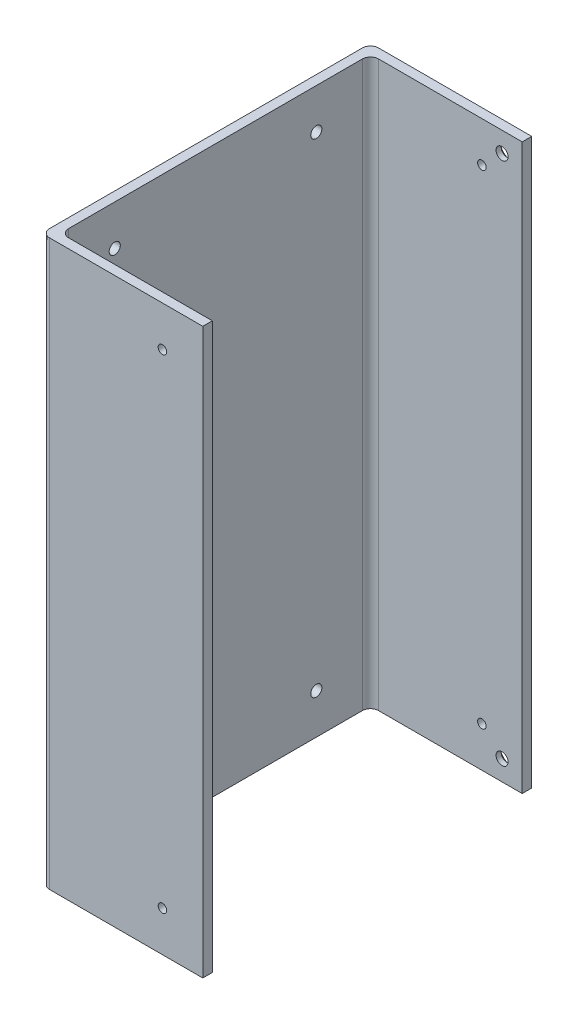
from build123d import *

# Parameters (mm, degrees)
EXTRUDE1_DEPTH                                    = 177.8
F_6_32_TAPPED_HOLE1_D                             = 2.7051
F_6_32_TAPPED_HOLE1_DEPTH                         = 9.38784
F_6_32_TAPPED_HOLE1_CBORE_D                       = 3.5052
F_6_32_TAPPED_HOLE1_CBORE_DEPTH                   = 7.0104
F_6_32_TAPPED_HOLE1_TIP                           = 0.81269403
F_6_32_TAPPED_HOLE2_D                             = 2.7051
F_6_32_TAPPED_HOLE2_DEPTH                         = 9.38784
F_6_32_TAPPED_HOLE2_TIP                           = 0.81269403
F_6_32_TAPPED_HOLE3_D                             = 2.7051
F_6_32_TAPPED_HOLE3_DEPTH                         = 9.38784
F_6_32_TAPPED_HOLE3_TIP                           = 0.81269403
CSK_FOR_6_FLAT_HEAD_MACHINE_SCREW_100_D           = 3.7973
CSK_FOR_6_FLAT_HEAD_MACHINE_SCREW_100_DEPTH       = 12.7
CSK_FOR_6_FLAT_HEAD_MACHINE_SCREW_100_CSINK_D     = 7.0866
CSK_FOR_6_FLAT_HEAD_MACHINE_SCREW_100_CSINK_ANGLE = 100
CSK_FOR_6_FLAT_HEAD_MACHINE_SCREW_100_TIP         = 1.140824014


with BuildPart() as part:
    # Sketch1 → Extrude1 (new body)
    with BuildSketch(Plane(origin=(0, 0, 0), x_dir=(1, 0, 0), z_dir=(0, 1, 0))):
        with BuildLine():
            Line((0, -2.54), (0, -101.092))
            ThreePointArc((0, -101.092), (0.743948776, -102.888051224), (2.54, -103.632))
            Line((2.54, -103.632), (50.8, -103.632))
            Line((50.8, -103.632), (50.8, -100.632))
            Line((50.8, -100.632), (5.54, -100.632))
            ThreePointArc((5.54, -100.632), (3.743948776, -99.888051224), (3, -98.092))
            Line((3, -98.092), (3, -5.54))
            ThreePointArc((3, -5.54), (3.743948776, -3.743948776), (5.54, -3))
            Line((5.54, -3), (50.8, -3))
            Line((50.8, -3), (50.8, 0))
            Line((50.8, 0), (2.54, 0))
            ThreePointArc((2.54, 0), (0.743948776, -0.743948776), (0, -2.54))
        make_face()
    extrude(amount=-EXTRUDE1_DEPTH)

    # #6-32 Tapped Hole1
    with Locations(Plane.ZY):
        with Locations((20.066, -12.7), (83.566, -12.7), (83.566, -165.1), (20.066, -165.1)):
            CounterBoreHole(F_6_32_TAPPED_HOLE1_D / 2, F_6_32_TAPPED_HOLE1_CBORE_D / 2, F_6_32_TAPPED_HOLE1_CBORE_DEPTH, depth=F_6_32_TAPPED_HOLE1_DEPTH)
            with Locations((0, 0, -(F_6_32_TAPPED_HOLE1_DEPTH + F_6_32_TAPPED_HOLE1_TIP / 2))):  # 118° drill point
                Cone(0, F_6_32_TAPPED_HOLE1_D / 2, F_6_32_TAPPED_HOLE1_TIP, mode=Mode.SUBTRACT)

    # #6-32 Tapped Hole2
    with Locations(Plane(origin=(0, 0, 0), x_dir=(-1, 0, 0), z_dir=(0, 0, -1))):
        with Locations((-38.1, -12.7), (-38.1, -165.1)):
            Hole(F_6_32_TAPPED_HOLE2_D / 2, depth=F_6_32_TAPPED_HOLE2_DEPTH)
            with Locations((0, 0, -(F_6_32_TAPPED_HOLE2_DEPTH + F_6_32_TAPPED_HOLE2_TIP / 2))):  # 118° drill point
                Cone(0, F_6_32_TAPPED_HOLE2_D / 2, F_6_32_TAPPED_HOLE2_TIP, mode=Mode.SUBTRACT)

    # #6-32 Tapped Hole3
    with Locations(Plane.XY.offset(103.632)):
        with Locations((38.1, -12.7), (38.1, -165.1)):
            Hole(F_6_32_TAPPED_HOLE3_D / 2, depth=F_6_32_TAPPED_HOLE3_DEPTH)
            with Locations((0, 0, -(F_6_32_TAPPED_HOLE3_DEPTH + F_6_32_TAPPED_HOLE3_TIP / 2))):  # 118° drill point
                Cone(0, F_6_32_TAPPED_HOLE3_D / 2, F_6_32_TAPPED_HOLE3_TIP, mode=Mode.SUBTRACT)

    # CSK for #6 Flat Head Machine Screw (100)1
    with Locations(Plane(origin=(0, 0, 0), x_dir=(-1, 0, 0), z_dir=(0, 0, -1))):
        with Locations((-44.45, -171.45), (-44.45, -6.35)):
            CounterSinkHole(CSK_FOR_6_FLAT_HEAD_MACHINE_SCREW_100_D / 2, CSK_FOR_6_FLAT_HEAD_MACHINE_SCREW_100_CSINK_D / 2, depth=CSK_FOR_6_FLAT_HEAD_MACHINE_SCREW_100_DEPTH, counter_sink_angle=CSK_FOR_6_FLAT_HEAD_MACHINE_SCREW_100_CSINK_ANGLE)
            with Locations((0, 0, -(CSK_FOR_6_FLAT_HEAD_MACHINE_SCREW_100_DEPTH + CSK_FOR_6_FLAT_HEAD_MACHINE_SCREW_100_TIP / 2))):  # 118° drill point
                Cone(0, CSK_FOR_6_FLAT_HEAD_MACHINE_SCREW_100_D / 2, CSK_FOR_6_FLAT_HEAD_MACHINE_SCREW_100_TIP, mode=Mode.SUBTRACT)


solid = part.part
